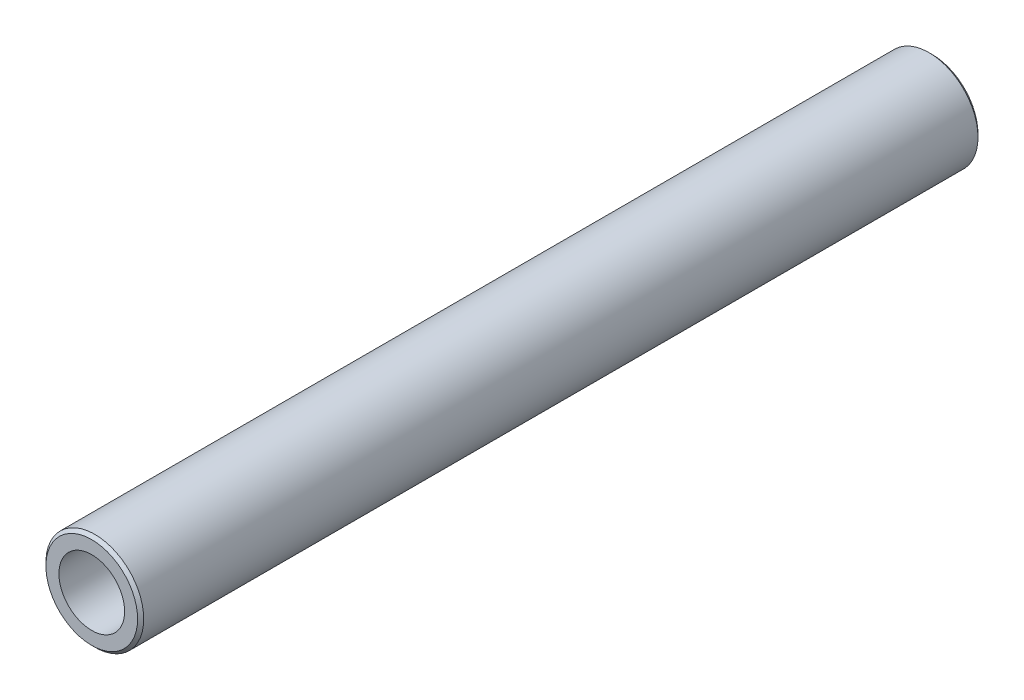
from build123d import *

# Parameters (mm, degrees)
SKETCH1_R           = 6.4
SKETCH1_R_2         = 4.3
BOSS_EXTRUDE1_DEPTH = 110
CHAMFER1_SIZE       = 0.4


with BuildPart() as part:
    # Sketch1 → Boss-Extrude1 (new body)
    with BuildSketch(Plane.XY):
        Circle(SKETCH1_R)
        Circle(SKETCH1_R_2, mode=Mode.SUBTRACT)
    extrude(amount=BOSS_EXTRUDE1_DEPTH)

    # Chamfer1
    chamfer1_edges = [part.edges().sort_by_distance(p)[0] for p in [
        (-6.4, 0, 0),
        (-6.4, 0, 110),
    ]]
    chamfer(chamfer1_edges, length=CHAMFER1_SIZE)


solid = part.part
